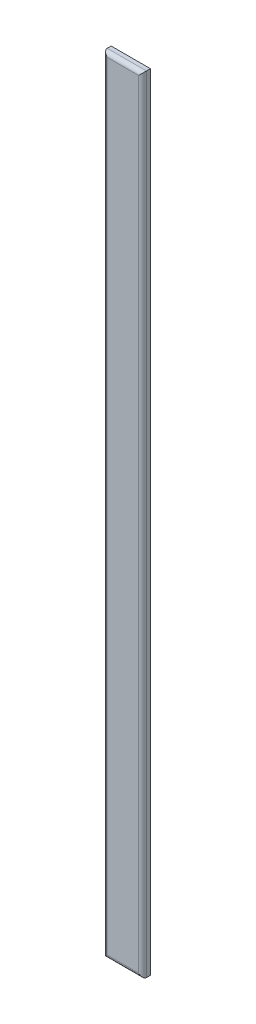
from build123d import *

# Parameters (mm, degrees)
SKETCH1_W           = 5
SKETCH1_H           = 100
BOSS_EXTRUDE1_DEPTH = 1
FILLET1_R           = 0.5


with BuildPart() as part:
    # Sketch1 → Boss-Extrude1 (new body)
    with BuildSketch(Plane.XY):
        with Locations((2.5, 50)):
            Rectangle(SKETCH1_W, SKETCH1_H)
    extrude(amount=BOSS_EXTRUDE1_DEPTH)

    # Fillet1
    fillet1_edges = [part.edges().sort_by_distance(p)[0] for p in [
        (5, 50, 1),
        (2.5, 100, 1),
        (0, 50, 1),
        (2.5, 0, 1),
    ]]
    fillet(fillet1_edges, radius=FILLET1_R)


solid = part.part
